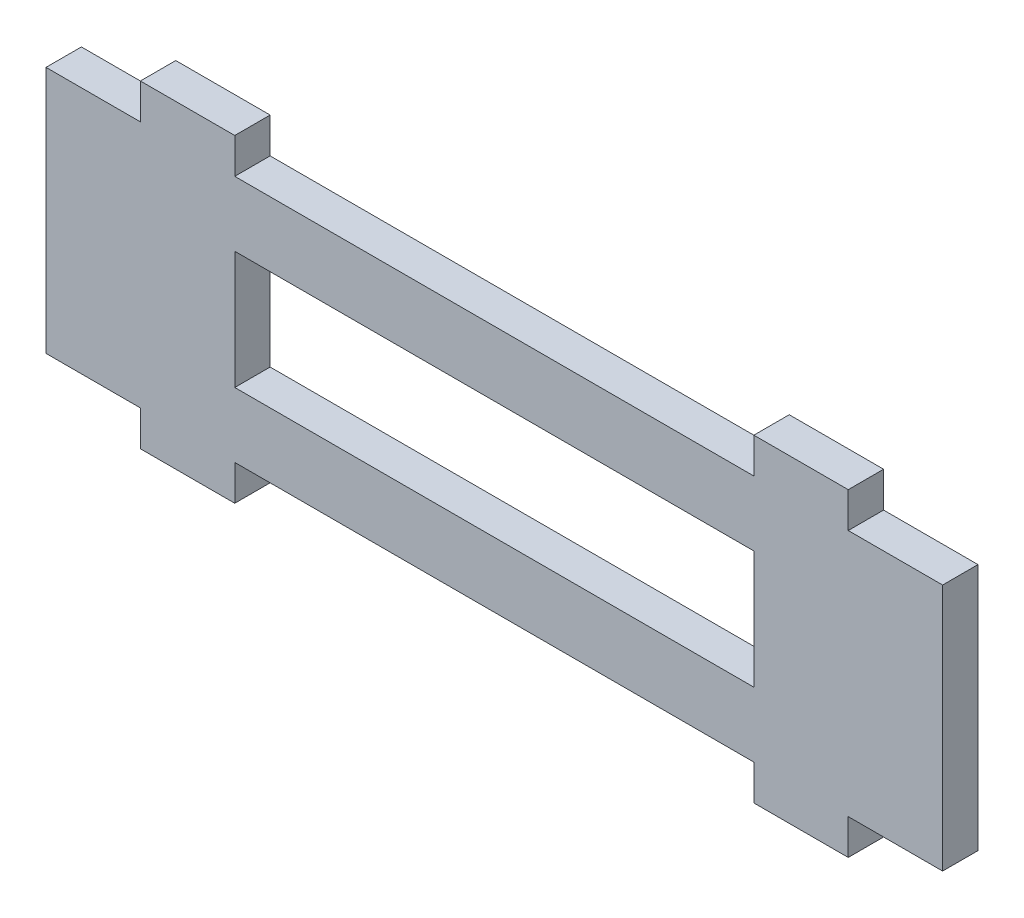
from build123d import *

# Parameters (mm, degrees)
SKETCH_1_W      = 44
SKETCH_1_H      = 10
EXTRUDE_1_DEPTH = 3


with BuildPart() as part:
    # 草图1 → 凸台-拉伸1 (new body)
    with BuildSketch(Plane.XY):
        Polygon((-38, -10.5), (-38, 10.5), (-30, 10.5), (-30, 13.5), (-22, 13.5), (-22, 10.5), (22, 10.5), (22, 13.5), (30, 13.5), (30, 10.5), (38, 10.5), (38, -10.5), (30, -10.5), (30, -13.5), (22, -13.5), (22, -10.5), (-22, -10.5), (-22, -13.5), (-30, -13.5), (-30, -10.5), align=None)
        Rectangle(SKETCH_1_W, SKETCH_1_H, mode=Mode.SUBTRACT)
    extrude(amount=EXTRUDE_1_DEPTH)


solid = part.part
